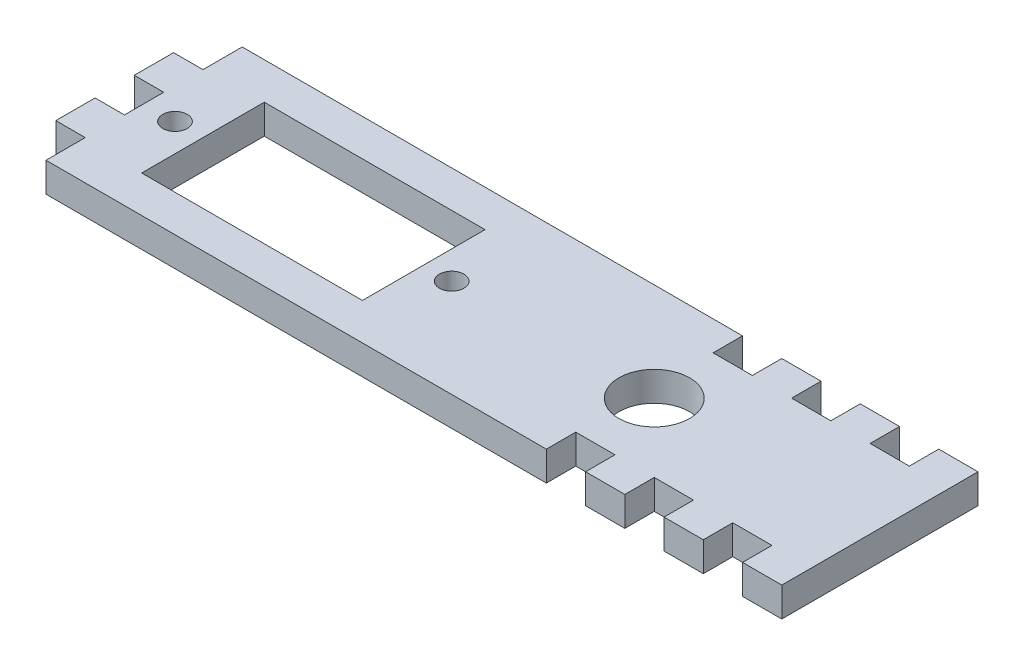
from build123d import *

# Parameters (mm, degrees)
CROQUIS1_R              = 1.25
CROQUIS1_W              = 22.5
CROQUIS1_H              = 12.5
CROQUIS1_R_2            = 3.6
CROQUIS1_W_2            = 3
CROQUIS1_H_2            = 4
SALIENTE_EXTRUIR1_DEPTH = 3


with BuildPart() as part:
    # Croquis1 → Saliente-Extruir1 (new body)
    # profile 1 of 3: a face of its own
    with BuildSketch(Plane(origin=(0, 0, 0), x_dir=(1, 0, 0), z_dir=(0, 1, 0))):
        Polygon((-37.5, -6), (-37.5, -10), (13.5, -10), (13.5, -7), (17.5, -7), (17.5, -10), (21.5, -10), (21.5, -7), (25.5, -7), (25.5, -10), (29.5, -10), (29.5, -7), (33.5, -7), (33.5, -10), (37.5, -10), (37.5, 10), (33.5, 10), (33.5, 7), (29.5, 7), (29.5, 10), (25.5, 10), (25.5, 7), (21.5, 7), (21.5, 10), (17.5, 10), (17.5, 7), (13.5, 7), (13.5, 10), (-37.5, 10), (-37.5, 6), (-37.5, 2), (-37.5, -2), align=None)
        with Locations(Location((-34.35, 0, 0), (0, 0, 270))):
            Circle(CROQUIS1_R, mode=Mode.SUBTRACT)
        with Locations((-20.25, 0)):
            Rectangle(CROQUIS1_W, CROQUIS1_H, mode=Mode.SUBTRACT)
        with Locations(Location((-6.15, 0, 0), (0, 0, 270))):
            Circle(CROQUIS1_R, mode=Mode.SUBTRACT)
        with Locations(Location((14.5, 0, 0), (0, 0, 270))):
            Circle(CROQUIS1_R_2, mode=Mode.SUBTRACT)
    # profile 2 of 3: a face of its own
    with BuildSketch(Plane(origin=(0, 0, 0), x_dir=(1, 0, 0), z_dir=(0, 1, 0))):
        with Locations((-39, -4)):
            Rectangle(CROQUIS1_W_2, CROQUIS1_H_2)
    # profile 3 of 3: a face of its own
    with BuildSketch(Plane(origin=(0, 0, 0), x_dir=(1, 0, 0), z_dir=(0, 1, 0))):
        with Locations((-39, 4)):
            Rectangle(CROQUIS1_W_2, CROQUIS1_H_2)
    extrude(amount=SALIENTE_EXTRUIR1_DEPTH)


solid = part.part
